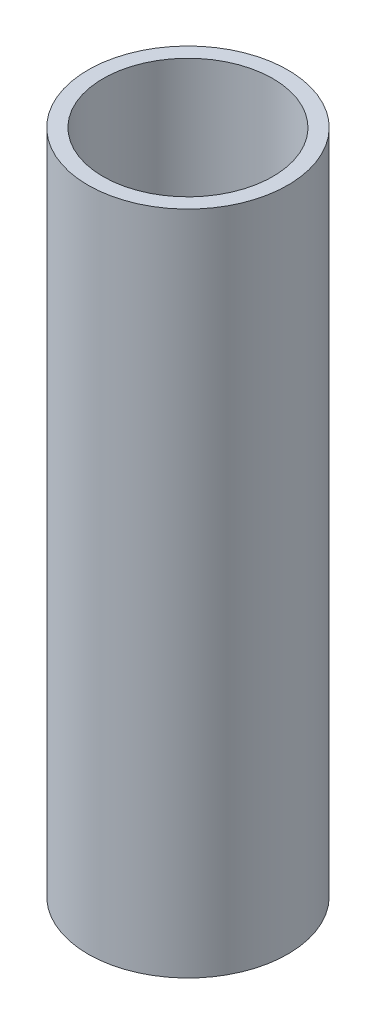
from build123d import *

# Parameters (mm, degrees)
SKETCH_1_R      = 30
SKETCH_1_R_2    = 25.5
EXTRUDE_1_DEPTH = 200


with BuildPart() as part:
    # 스케치1 → 보스-돌출1 (new body)
    with BuildSketch(Plane(origin=(0, 0, 0), x_dir=(1, 0, 0), z_dir=(0, 1, 0))):
        with Locations(Location((0, 0, 0), (0, 0, 270))):
            Circle(SKETCH_1_R)
        with Locations(Location((0, 0, 0), (0, 0, 270))):
            Circle(SKETCH_1_R_2, mode=Mode.SUBTRACT)
    extrude(amount=EXTRUDE_1_DEPTH)


solid = part.part
